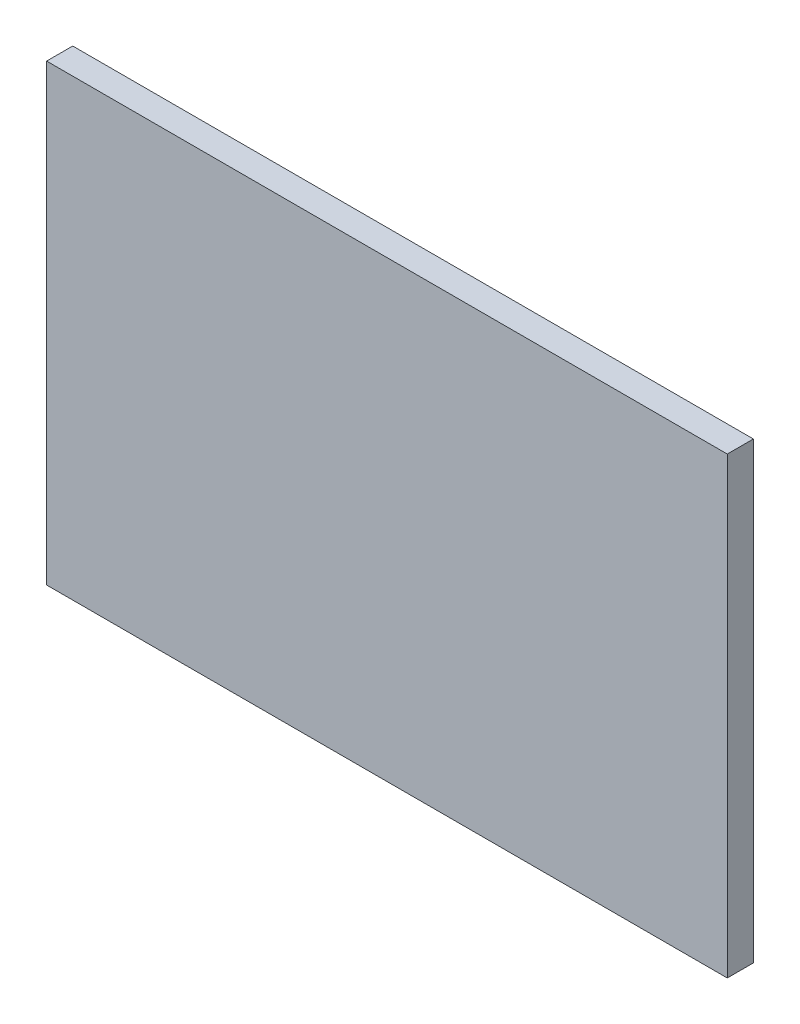
from build123d import *

# Parameters (mm, degrees)
SKETCH1_W           = 76.2
SKETCH1_H           = 50.8
BOSS_EXTRUDE1_DEPTH = 2.921


with BuildPart() as part:
    # Sketch1 → Boss-Extrude1 (new body)
    with BuildSketch(Plane.XY):
        with Locations((38.1, 25.4)):
            Rectangle(SKETCH1_W, SKETCH1_H)
    extrude(amount=-BOSS_EXTRUDE1_DEPTH)


solid = part.part
